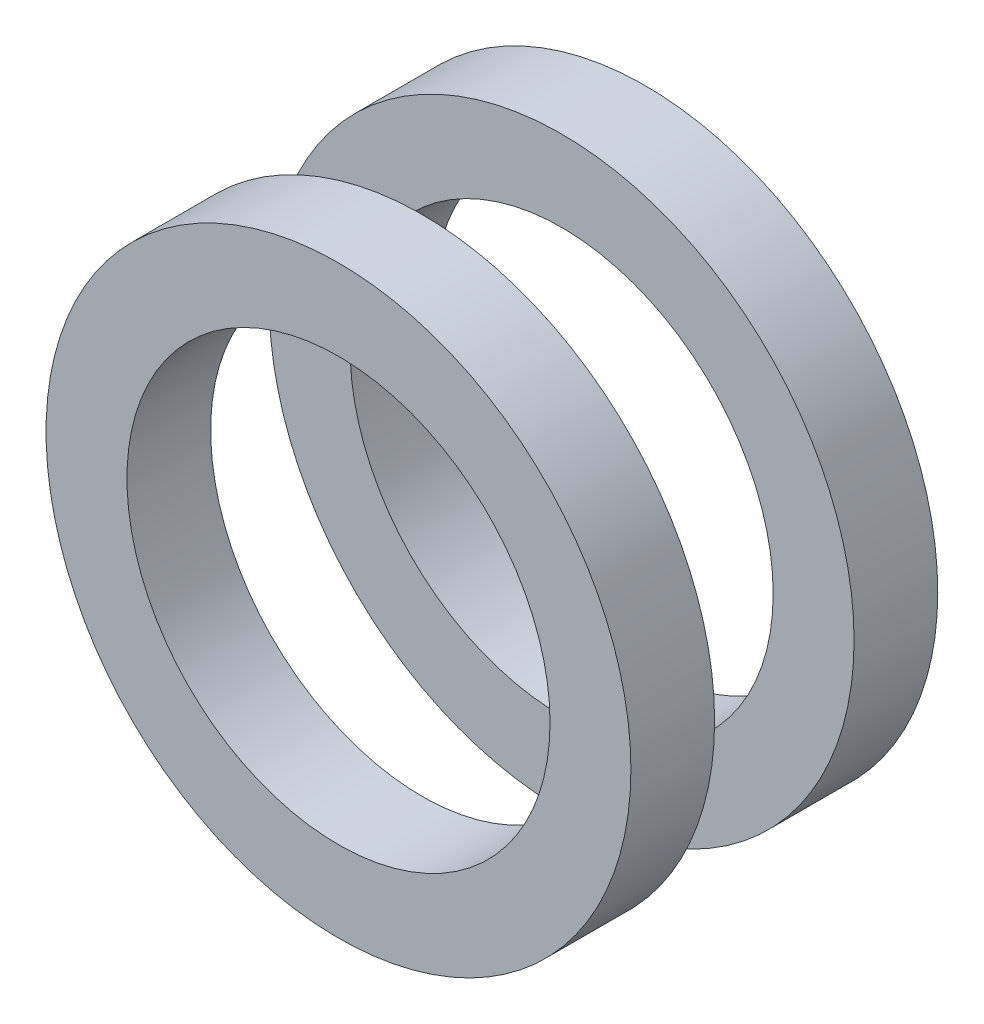
from build123d import *

# Parameters (mm, degrees)
ENDTURN_R_START = 15
SKETCH_1_R      = 62.9
SKETCH_1_R_2    = 45.5
ENDTURN_R_DEPTH = 18
ENDTURN_L_START = -33
SKETCH_2_R      = 62.9
SKETCH_2_R_2    = 45.5
ENDTURN_L_DEPTH = 18


with BuildPart() as part:
    # Эскиз1 → Endturn_R (new body)
    with BuildSketch(Plane.XY.offset(ENDTURN_R_START)):
        Circle(SKETCH_1_R)
        Circle(SKETCH_1_R_2, mode=Mode.SUBTRACT)
    extrude(amount=ENDTURN_R_DEPTH)


with BuildPart() as body_2:
    # Эскиз2 → Endturn_L (new body)
    with BuildSketch(Plane.XY.offset(ENDTURN_L_START)):
        Circle(SKETCH_2_R)
        Circle(SKETCH_2_R_2, mode=Mode.SUBTRACT)
    extrude(amount=ENDTURN_L_DEPTH)


solid = Compound([part.part, body_2.part])
